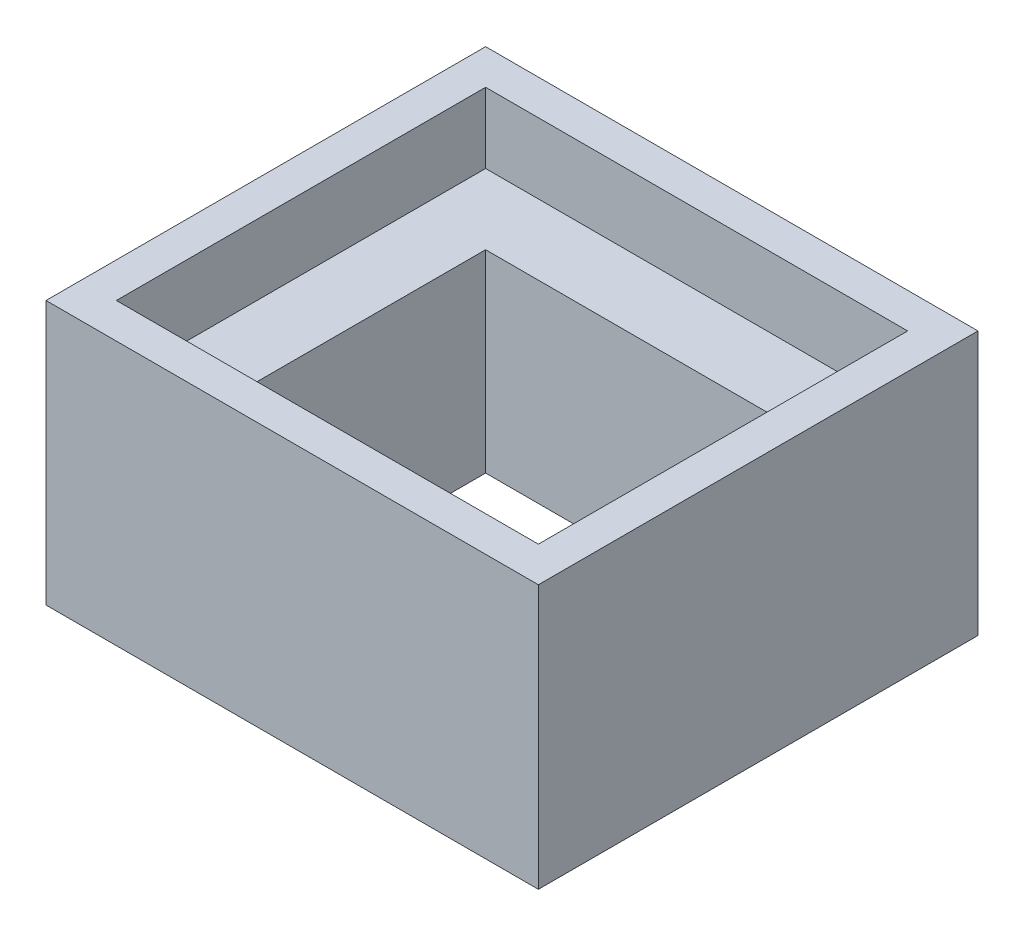
from build123d import *

# Parameters (mm, degrees)
SKETCH1_W               = 56
SKETCH1_H               = 50
BOSS_EXTRUDE1_DEPTH     = 30
SKETCH3_W               = 48
SKETCH3_H               = 42
CUT_EXTRUDE1_DEPTH      = 8
CUT_EXTRUDE2_DEPTH      = 44.508619836
CUT_EXTRUDE2_DEPTH_BACK = 44.508619836
SKETCH5_W               = 32
SKETCH5_H               = 26


with BuildPart() as part:
    # Sketch1 → Boss-Extrude1 (new body)
    with BuildSketch(Plane(origin=(0, 0, 0), x_dir=(1, 0, 0), z_dir=(0, 1, 0))):
        Rectangle(SKETCH1_W, SKETCH1_H)
    extrude(amount=BOSS_EXTRUDE1_DEPTH)

    # Sketch3 → Cut-Extrude1 (cut)
    with BuildSketch(Plane(origin=(0, 30, 0), x_dir=(1, 0, 0), z_dir=(0, 1, 0))):
        Rectangle(SKETCH3_W, SKETCH3_H)
    extrude(amount=-CUT_EXTRUDE1_DEPTH, mode=Mode.SUBTRACT)

    # Sketch5 → Cut-Extrude2 (cut, two sides: drawn at the far end of the back side and taken through both)
    with BuildSketch(Plane(origin=(0, 22, 0), x_dir=(1, 0, 0), z_dir=(0, 1, 0)).offset(-CUT_EXTRUDE2_DEPTH_BACK)):
        Rectangle(SKETCH5_W, SKETCH5_H)
    extrude(amount=CUT_EXTRUDE2_DEPTH + CUT_EXTRUDE2_DEPTH_BACK, mode=Mode.SUBTRACT)


solid = part.part
